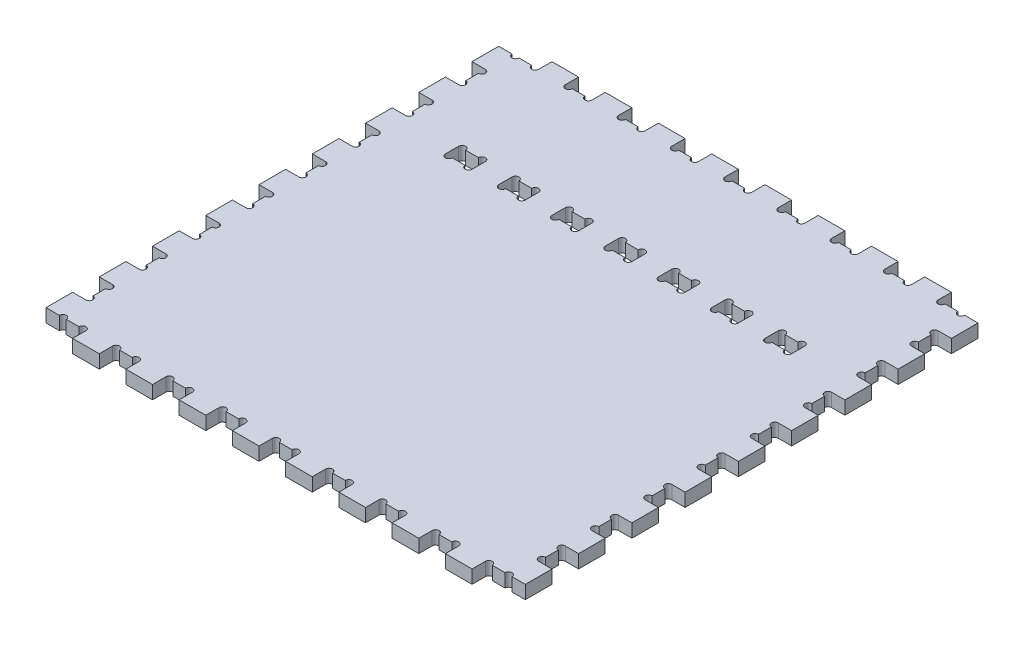
from build123d import *

# Parameters (mm, degrees)
SKETCH1_W               = 457.2
SKETCH1_H               = 457.2
BOSS_EXTRUDE1_DEPTH     = 12.7
CUT_EXTRUDE1_DEPTH      = 12.7
LPATTERN1_COUNT         = 9
LPATTERN1_PITCH         = 50.8
MIRROR1_COPY_1_DEPTH    = 12.7
MIRROR1_COPY_2_DEPTH    = 12.7
MIRROR1_COPY_3_DEPTH    = 12.7
MIRROR1_COPY_4_DEPTH    = 12.7
MIRROR1_COPY_5_DEPTH    = 12.7
MIRROR1_COPY_6_DEPTH    = 12.7
MIRROR1_COPY_7_DEPTH    = 12.7
MIRROR1_COPY_8_DEPTH    = 12.7
SKETCH3_W               = 12.7
SKETCH3_H               = 12.7
CUT_EXTRUDE2_DEPTH      = 324.538575753
MIRROR3_COPY_1_SKETCH_W = 12.7
MIRROR3_COPY_1_SKETCH_H = 12.7
MIRROR3_COPY_1_DEPTH    = 324.538575753
SKETCH4_R               = 3.302
SKETCH4_W               = 12.7
SKETCH4_H               = 25.4
CUT_EXTRUDE3_DEPTH      = 324.538575753
LPATTERN2_COUNT         = 9
LPATTERN2_PITCH         = 50.8
MIRROR4_COPY_1_SKETCH_R = 3.302
MIRROR4_COPY_1_SKETCH_W = 12.7
MIRROR4_COPY_1_SKETCH_H = 25.4
MIRROR4_COPY_1_DEPTH    = 324.538575753
MIRROR4_COPY_2_SKETCH_R = 3.302
MIRROR4_COPY_2_SKETCH_W = 12.7
MIRROR4_COPY_2_SKETCH_H = 25.4
MIRROR4_COPY_2_DEPTH    = 324.538575753
MIRROR4_COPY_3_SKETCH_R = 3.302
MIRROR4_COPY_3_SKETCH_W = 12.7
MIRROR4_COPY_3_SKETCH_H = 25.4
MIRROR4_COPY_3_DEPTH    = 324.538575753
MIRROR4_COPY_4_SKETCH_R = 3.302
MIRROR4_COPY_4_SKETCH_W = 12.7
MIRROR4_COPY_4_SKETCH_H = 25.4
MIRROR4_COPY_4_DEPTH    = 324.538575753
MIRROR4_COPY_5_SKETCH_R = 3.302
MIRROR4_COPY_5_SKETCH_W = 12.7
MIRROR4_COPY_5_SKETCH_H = 25.4
MIRROR4_COPY_5_DEPTH    = 324.538575753
MIRROR4_COPY_6_SKETCH_R = 3.302
MIRROR4_COPY_6_SKETCH_W = 12.7
MIRROR4_COPY_6_SKETCH_H = 25.4
MIRROR4_COPY_6_DEPTH    = 324.538575753
MIRROR4_COPY_7_SKETCH_R = 3.302
MIRROR4_COPY_7_SKETCH_W = 12.7
MIRROR4_COPY_7_SKETCH_H = 25.4
MIRROR4_COPY_7_DEPTH    = 324.538575753
MIRROR4_COPY_8_SKETCH_R = 3.302
MIRROR4_COPY_8_SKETCH_W = 12.7
MIRROR4_COPY_8_SKETCH_H = 25.4
MIRROR4_COPY_8_DEPTH    = 324.538575753
CUT_EXTRUDE4_DEPTH      = 324.538575753
LPATTERN3_COUNT         = 7
LPATTERN3_PITCH         = 50.8


with BuildPart() as part:
    # Sketch1 → Boss-Extrude1 (new body)
    with BuildSketch(Plane(origin=(0, 0, 0), x_dir=(1, 0, 0), z_dir=(0, 1, 0))):
        Rectangle(SKETCH1_W, SKETCH1_H)
    extrude(amount=BOSS_EXTRUDE1_DEPTH)

    # Sketch2 → Cut-Extrude1 (cut)
    with BuildSketch(Plane(origin=(0, 12.7, 0), x_dir=(1, 0, 0), z_dir=(0, 1, 0))):
        with BuildLine():
            Line((-190.5, 228.6), (-215.9, 228.6))
            Line((-215.9, 228.6), (-215.9, 215.9))
            ThreePointArc((-215.9, 215.9), (-212.598, 219.202), (-209.296, 215.9))
            Line((-209.296, 215.9), (-197.104, 215.9))
            ThreePointArc((-197.104, 215.9), (-193.802, 219.202), (-190.5, 215.9))
            Line((-190.5, 215.9), (-190.5, 228.6))
        make_face()
        with BuildLine():
            ThreePointArc((-209.296, 215.9), (-212.598, 219.202), (-215.9, 215.9))
            Line((-215.9, 215.9), (-209.296, 215.9))
        make_face()
        with BuildLine():
            Line((-209.296, 215.9), (-215.9, 215.9))
            ThreePointArc((-215.9, 215.9), (-212.598, 212.598), (-209.296, 215.9))
        make_face()
        with BuildLine():
            ThreePointArc((-197.104, 215.9), (-193.802, 212.598), (-190.5, 215.9))
            Line((-190.5, 215.9), (-197.104, 215.9))
        make_face()
        with BuildLine():
            Line((-197.104, 215.9), (-190.5, 215.9))
            ThreePointArc((-190.5, 215.9), (-193.802, 219.202), (-197.104, 215.9))
        make_face()
    cut_extrude1 = extrude(amount=-CUT_EXTRUDE1_DEPTH, mode=Mode.SUBTRACT)

    # LPattern1: Cut-Extrude1 ×9
    with Locations(*[(i * LPATTERN1_PITCH, 0, 0) for i in range(1, LPATTERN1_COUNT)]):
        add(cut_extrude1, mode=Mode.SUBTRACT)

    # Mirror1: Cut-Extrude1 across plane
    add(cut_extrude1.mirror(Plane(origin=(0, 0, 0), x_dir=(1, 0, 0), z_dir=(0, 0, -1))), mode=Mode.SUBTRACT)

    # Mirror1 copy 1 sketch → Mirror1 copy 1 (cut)
    with BuildSketch(Plane(origin=(50.8, 12.7, 0), x_dir=(1, 0, 0), z_dir=(0, 1, 0))):
        with BuildLine():
            Line((-190.5, -228.6), (-215.9, -228.6))
            Line((-215.9, -228.6), (-215.9, -215.9))
            ThreePointArc((-215.9, -215.9), (-212.598, -219.202), (-209.296, -215.9))
            Line((-209.296, -215.9), (-197.104, -215.9))
            ThreePointArc((-197.104, -215.9), (-193.802, -219.202), (-190.5, -215.9))
            Line((-190.5, -215.9), (-190.5, -228.6))
        make_face()
        with BuildLine():
            ThreePointArc((-209.296, -215.9), (-212.598, -219.202), (-215.9, -215.9))
            Line((-215.9, -215.9), (-209.296, -215.9))
        make_face()
        with BuildLine():
            Line((-209.296, -215.9), (-215.9, -215.9))
            ThreePointArc((-215.9, -215.9), (-212.598, -212.598), (-209.296, -215.9))
        make_face()
        with BuildLine():
            ThreePointArc((-197.104, -215.9), (-193.802, -212.598), (-190.5, -215.9))
            Line((-190.5, -215.9), (-197.104, -215.9))
        make_face()
        with BuildLine():
            Line((-197.104, -215.9), (-190.5, -215.9))
            ThreePointArc((-190.5, -215.9), (-193.802, -219.202), (-197.104, -215.9))
        make_face()
    extrude(amount=-MIRROR1_COPY_1_DEPTH, mode=Mode.SUBTRACT)

    # Mirror1 copy 2 sketch → Mirror1 copy 2 (cut)
    with BuildSketch(Plane(origin=(101.6, 12.7, 0), x_dir=(1, 0, 0), z_dir=(0, 1, 0))):
        with BuildLine():
            Line((-190.5, -228.6), (-215.9, -228.6))
            Line((-215.9, -228.6), (-215.9, -215.9))
            ThreePointArc((-215.9, -215.9), (-212.598, -219.202), (-209.296, -215.9))
            Line((-209.296, -215.9), (-197.104, -215.9))
            ThreePointArc((-197.104, -215.9), (-193.802, -219.202), (-190.5, -215.9))
            Line((-190.5, -215.9), (-190.5, -228.6))
        make_face()
        with BuildLine():
            ThreePointArc((-209.296, -215.9), (-212.598, -219.202), (-215.9, -215.9))
            Line((-215.9, -215.9), (-209.296, -215.9))
        make_face()
        with BuildLine():
            Line((-209.296, -215.9), (-215.9, -215.9))
            ThreePointArc((-215.9, -215.9), (-212.598, -212.598), (-209.296, -215.9))
        make_face()
        with BuildLine():
            ThreePointArc((-197.104, -215.9), (-193.802, -212.598), (-190.5, -215.9))
            Line((-190.5, -215.9), (-197.104, -215.9))
        make_face()
        with BuildLine():
            Line((-197.104, -215.9), (-190.5, -215.9))
            ThreePointArc((-190.5, -215.9), (-193.802, -219.202), (-197.104, -215.9))
        make_face()
    extrude(amount=-MIRROR1_COPY_2_DEPTH, mode=Mode.SUBTRACT)

    # Mirror1 copy 3 sketch → Mirror1 copy 3 (cut)
    with BuildSketch(Plane(origin=(152.4, 12.7, 0), x_dir=(1, 0, 0), z_dir=(0, 1, 0))):
        with BuildLine():
            Line((-190.5, -228.6), (-215.9, -228.6))
            Line((-215.9, -228.6), (-215.9, -215.9))
            ThreePointArc((-215.9, -215.9), (-212.598, -219.202), (-209.296, -215.9))
            Line((-209.296, -215.9), (-197.104, -215.9))
            ThreePointArc((-197.104, -215.9), (-193.802, -219.202), (-190.5, -215.9))
            Line((-190.5, -215.9), (-190.5, -228.6))
        make_face()
        with BuildLine():
            ThreePointArc((-209.296, -215.9), (-212.598, -219.202), (-215.9, -215.9))
            Line((-215.9, -215.9), (-209.296, -215.9))
        make_face()
        with BuildLine():
            Line((-209.296, -215.9), (-215.9, -215.9))
            ThreePointArc((-215.9, -215.9), (-212.598, -212.598), (-209.296, -215.9))
        make_face()
        with BuildLine():
            ThreePointArc((-197.104, -215.9), (-193.802, -212.598), (-190.5, -215.9))
            Line((-190.5, -215.9), (-197.104, -215.9))
        make_face()
        with BuildLine():
            Line((-197.104, -215.9), (-190.5, -215.9))
            ThreePointArc((-190.5, -215.9), (-193.802, -219.202), (-197.104, -215.9))
        make_face()
    extrude(amount=-MIRROR1_COPY_3_DEPTH, mode=Mode.SUBTRACT)

    # Mirror1 copy 4 sketch → Mirror1 copy 4 (cut)
    with BuildSketch(Plane(origin=(203.2, 12.7, 0), x_dir=(1, 0, 0), z_dir=(0, 1, 0))):
        with BuildLine():
            Line((-190.5, -228.6), (-215.9, -228.6))
            Line((-215.9, -228.6), (-215.9, -215.9))
            ThreePointArc((-215.9, -215.9), (-212.598, -219.202), (-209.296, -215.9))
            Line((-209.296, -215.9), (-197.104, -215.9))
            ThreePointArc((-197.104, -215.9), (-193.802, -219.202), (-190.5, -215.9))
            Line((-190.5, -215.9), (-190.5, -228.6))
        make_face()
        with BuildLine():
            ThreePointArc((-209.296, -215.9), (-212.598, -219.202), (-215.9, -215.9))
            Line((-215.9, -215.9), (-209.296, -215.9))
        make_face()
        with BuildLine():
            Line((-209.296, -215.9), (-215.9, -215.9))
            ThreePointArc((-215.9, -215.9), (-212.598, -212.598), (-209.296, -215.9))
        make_face()
        with BuildLine():
            ThreePointArc((-197.104, -215.9), (-193.802, -212.598), (-190.5, -215.9))
            Line((-190.5, -215.9), (-197.104, -215.9))
        make_face()
        with BuildLine():
            Line((-197.104, -215.9), (-190.5, -215.9))
            ThreePointArc((-190.5, -215.9), (-193.802, -219.202), (-197.104, -215.9))
        make_face()
    extrude(amount=-MIRROR1_COPY_4_DEPTH, mode=Mode.SUBTRACT)

    # Mirror1 copy 5 sketch → Mirror1 copy 5 (cut)
    with BuildSketch(Plane(origin=(254, 12.7, 0), x_dir=(1, 0, 0), z_dir=(0, 1, 0))):
        with BuildLine():
            Line((-190.5, -228.6), (-215.9, -228.6))
            Line((-215.9, -228.6), (-215.9, -215.9))
            ThreePointArc((-215.9, -215.9), (-212.598, -219.202), (-209.296, -215.9))
            Line((-209.296, -215.9), (-197.104, -215.9))
            ThreePointArc((-197.104, -215.9), (-193.802, -219.202), (-190.5, -215.9))
            Line((-190.5, -215.9), (-190.5, -228.6))
        make_face()
        with BuildLine():
            ThreePointArc((-209.296, -215.9), (-212.598, -219.202), (-215.9, -215.9))
            Line((-215.9, -215.9), (-209.296, -215.9))
        make_face()
        with BuildLine():
            Line((-209.296, -215.9), (-215.9, -215.9))
            ThreePointArc((-215.9, -215.9), (-212.598, -212.598), (-209.296, -215.9))
        make_face()
        with BuildLine():
            ThreePointArc((-197.104, -215.9), (-193.802, -212.598), (-190.5, -215.9))
            Line((-190.5, -215.9), (-197.104, -215.9))
        make_face()
        with BuildLine():
            Line((-197.104, -215.9), (-190.5, -215.9))
            ThreePointArc((-190.5, -215.9), (-193.802, -219.202), (-197.104, -215.9))
        make_face()
    extrude(amount=-MIRROR1_COPY_5_DEPTH, mode=Mode.SUBTRACT)

    # Mirror1 copy 6 sketch → Mirror1 copy 6 (cut)
    with BuildSketch(Plane(origin=(304.8, 12.7, 0), x_dir=(1, 0, 0), z_dir=(0, 1, 0))):
        with BuildLine():
            Line((-190.5, -228.6), (-215.9, -228.6))
            Line((-215.9, -228.6), (-215.9, -215.9))
            ThreePointArc((-215.9, -215.9), (-212.598, -219.202), (-209.296, -215.9))
            Line((-209.296, -215.9), (-197.104, -215.9))
            ThreePointArc((-197.104, -215.9), (-193.802, -219.202), (-190.5, -215.9))
            Line((-190.5, -215.9), (-190.5, -228.6))
        make_face()
        with BuildLine():
            ThreePointArc((-209.296, -215.9), (-212.598, -219.202), (-215.9, -215.9))
            Line((-215.9, -215.9), (-209.296, -215.9))
        make_face()
        with BuildLine():
            Line((-209.296, -215.9), (-215.9, -215.9))
            ThreePointArc((-215.9, -215.9), (-212.598, -212.598), (-209.296, -215.9))
        make_face()
        with BuildLine():
            ThreePointArc((-197.104, -215.9), (-193.802, -212.598), (-190.5, -215.9))
            Line((-190.5, -215.9), (-197.104, -215.9))
        make_face()
        with BuildLine():
            Line((-197.104, -215.9), (-190.5, -215.9))
            ThreePointArc((-190.5, -215.9), (-193.802, -219.202), (-197.104, -215.9))
        make_face()
    extrude(amount=-MIRROR1_COPY_6_DEPTH, mode=Mode.SUBTRACT)

    # Mirror1 copy 7 sketch → Mirror1 copy 7 (cut)
    with BuildSketch(Plane(origin=(355.6, 12.7, 0), x_dir=(1, 0, 0), z_dir=(0, 1, 0))):
        with BuildLine():
            Line((-190.5, -228.6), (-215.9, -228.6))
            Line((-215.9, -228.6), (-215.9, -215.9))
            ThreePointArc((-215.9, -215.9), (-212.598, -219.202), (-209.296, -215.9))
            Line((-209.296, -215.9), (-197.104, -215.9))
            ThreePointArc((-197.104, -215.9), (-193.802, -219.202), (-190.5, -215.9))
            Line((-190.5, -215.9), (-190.5, -228.6))
        make_face()
        with BuildLine():
            ThreePointArc((-209.296, -215.9), (-212.598, -219.202), (-215.9, -215.9))
            Line((-215.9, -215.9), (-209.296, -215.9))
        make_face()
        with BuildLine():
            Line((-209.296, -215.9), (-215.9, -215.9))
            ThreePointArc((-215.9, -215.9), (-212.598, -212.598), (-209.296, -215.9))
        make_face()
        with BuildLine():
            ThreePointArc((-197.104, -215.9), (-193.802, -212.598), (-190.5, -215.9))
            Line((-190.5, -215.9), (-197.104, -215.9))
        make_face()
        with BuildLine():
            Line((-197.104, -215.9), (-190.5, -215.9))
            ThreePointArc((-190.5, -215.9), (-193.802, -219.202), (-197.104, -215.9))
        make_face()
    extrude(amount=-MIRROR1_COPY_7_DEPTH, mode=Mode.SUBTRACT)

    # Mirror1 copy 8 sketch → Mirror1 copy 8 (cut)
    with BuildSketch(Plane(origin=(406.4, 12.7, 0), x_dir=(1, 0, 0), z_dir=(0, 1, 0))):
        with BuildLine():
            Line((-190.5, -228.6), (-215.9, -228.6))
            Line((-215.9, -228.6), (-215.9, -215.9))
            ThreePointArc((-215.9, -215.9), (-212.598, -219.202), (-209.296, -215.9))
            Line((-209.296, -215.9), (-197.104, -215.9))
            ThreePointArc((-197.104, -215.9), (-193.802, -219.202), (-190.5, -215.9))
            Line((-190.5, -215.9), (-190.5, -228.6))
        make_face()
        with BuildLine():
            ThreePointArc((-209.296, -215.9), (-212.598, -219.202), (-215.9, -215.9))
            Line((-215.9, -215.9), (-209.296, -215.9))
        make_face()
        with BuildLine():
            Line((-209.296, -215.9), (-215.9, -215.9))
            ThreePointArc((-215.9, -215.9), (-212.598, -212.598), (-209.296, -215.9))
        make_face()
        with BuildLine():
            ThreePointArc((-197.104, -215.9), (-193.802, -212.598), (-190.5, -215.9))
            Line((-190.5, -215.9), (-197.104, -215.9))
        make_face()
        with BuildLine():
            Line((-197.104, -215.9), (-190.5, -215.9))
            ThreePointArc((-190.5, -215.9), (-193.802, -219.202), (-197.104, -215.9))
        make_face()
    extrude(amount=-MIRROR1_COPY_8_DEPTH, mode=Mode.SUBTRACT)

    # Sketch3 → Cut-Extrude2 (cut, through all)
    with BuildSketch(Plane(origin=(0, 12.7, 0), x_dir=(1, 0, 0), z_dir=(0, 1, 0))):
        with Locations((-222.25, 222.25)):
            Rectangle(SKETCH3_W, SKETCH3_H)
    cut_extrude2 = extrude(amount=-CUT_EXTRUDE2_DEPTH, mode=Mode.SUBTRACT)

    # Mirror2: Cut-Extrude2 across plane
    add(cut_extrude2.mirror(Plane.ZY), mode=Mode.SUBTRACT)

    # Mirror3: Cut-Extrude2 across plane
    add(cut_extrude2.mirror(Plane(origin=(0, 0, 0), x_dir=(1, 0, 0), z_dir=(0, 0, -1))), mode=Mode.SUBTRACT)

    # Mirror3 copy 1 sketch → Mirror3 copy 1 (cut, through all)
    with BuildSketch(Plane(origin=(0, 12.7, 0), x_dir=(-1, 0, 0), z_dir=(0, 1, 0))):
        with Locations((-222.25, 222.25)):
            Rectangle(MIRROR3_COPY_1_SKETCH_W, MIRROR3_COPY_1_SKETCH_H)
    extrude(amount=-MIRROR3_COPY_1_DEPTH, mode=Mode.SUBTRACT)

    # Sketch4 → Cut-Extrude3 (cut, through all)
    with BuildSketch(Plane(origin=(0, 12.7, 0), x_dir=(1, 0, 0), z_dir=(0, 1, 0))):
        with Locations((-215.9, 168.402)):
            Circle(SKETCH4_R)
        with Locations((-215.9, 187.198)):
            Circle(SKETCH4_R)
        with Locations((-222.25, 177.8)):
            Rectangle(SKETCH4_W, SKETCH4_H)
        with BuildLine():
            ThreePointArc((-212.598, 187.198), (-213.565133409, 189.532866591), (-215.9, 190.5))
            Line((-215.9, 190.5), (-215.9, 183.896))
            ThreePointArc((-215.9, 183.896), (-213.565133409, 184.863133409), (-212.598, 187.198))
        make_face()
        with BuildLine():
            Line((-215.9, 183.896), (-215.9, 190.5))
            ThreePointArc((-215.9, 190.5), (-219.202, 187.198), (-215.9, 183.896))
        make_face()
        with BuildLine():
            ThreePointArc((-215.9, 171.704), (-219.202, 168.402), (-215.9, 165.1))
            Line((-215.9, 165.1), (-215.9, 171.704))
        make_face()
        with BuildLine():
            Line((-215.9, 171.704), (-215.9, 165.1))
            ThreePointArc((-215.9, 165.1), (-213.565133409, 166.067133409), (-212.598, 168.402))
            ThreePointArc((-212.598, 168.402), (-213.565133409, 170.736866591), (-215.9, 171.704))
        make_face()
    cut_extrude3 = extrude(amount=-CUT_EXTRUDE3_DEPTH, mode=Mode.SUBTRACT)

    # LPattern2: Cut-Extrude3 ×9
    with Locations(*[(0, 0, i * LPATTERN2_PITCH) for i in range(1, LPATTERN2_COUNT)]):
        add(cut_extrude3, mode=Mode.SUBTRACT)

    # Mirror4: Cut-Extrude3 across plane
    add(cut_extrude3.mirror(Plane.ZY), mode=Mode.SUBTRACT)

    # Mirror4 copy 1 sketch → Mirror4 copy 1 (cut, through all)
    with BuildSketch(Plane(origin=(0, 12.7, 50.8), x_dir=(-1, 0, 0), z_dir=(0, 1, 0))):
        with Locations((-215.9, -168.402)):
            Circle(MIRROR4_COPY_1_SKETCH_R)
        with Locations((-215.9, -187.198)):
            Circle(MIRROR4_COPY_1_SKETCH_R)
        with Locations((-222.25, -177.8)):
            Rectangle(MIRROR4_COPY_1_SKETCH_W, MIRROR4_COPY_1_SKETCH_H)
        with BuildLine():
            ThreePointArc((-212.598, -187.198), (-213.565133409, -189.532866591), (-215.9, -190.5))
            Line((-215.9, -190.5), (-215.9, -183.896))
            ThreePointArc((-215.9, -183.896), (-213.565133409, -184.863133409), (-212.598, -187.198))
        make_face()
        with BuildLine():
            Line((-215.9, -183.896), (-215.9, -190.5))
            ThreePointArc((-215.9, -190.5), (-219.202, -187.198), (-215.9, -183.896))
        make_face()
        with BuildLine():
            ThreePointArc((-215.9, -171.704), (-219.202, -168.402), (-215.9, -165.1))
            Line((-215.9, -165.1), (-215.9, -171.704))
        make_face()
        with BuildLine():
            Line((-215.9, -171.704), (-215.9, -165.1))
            ThreePointArc((-215.9, -165.1), (-213.565133409, -166.067133409), (-212.598, -168.402))
            ThreePointArc((-212.598, -168.402), (-213.565133409, -170.736866591), (-215.9, -171.704))
        make_face()
    extrude(amount=-MIRROR4_COPY_1_DEPTH, mode=Mode.SUBTRACT)

    # Mirror4 copy 2 sketch → Mirror4 copy 2 (cut, through all)
    with BuildSketch(Plane(origin=(0, 12.7, 101.6), x_dir=(-1, 0, 0), z_dir=(0, 1, 0))):
        with Locations((-215.9, -168.402)):
            Circle(MIRROR4_COPY_2_SKETCH_R)
        with Locations((-215.9, -187.198)):
            Circle(MIRROR4_COPY_2_SKETCH_R)
        with Locations((-222.25, -177.8)):
            Rectangle(MIRROR4_COPY_2_SKETCH_W, MIRROR4_COPY_2_SKETCH_H)
        with BuildLine():
            ThreePointArc((-212.598, -187.198), (-213.565133409, -189.532866591), (-215.9, -190.5))
            Line((-215.9, -190.5), (-215.9, -183.896))
            ThreePointArc((-215.9, -183.896), (-213.565133409, -184.863133409), (-212.598, -187.198))
        make_face()
        with BuildLine():
            Line((-215.9, -183.896), (-215.9, -190.5))
            ThreePointArc((-215.9, -190.5), (-219.202, -187.198), (-215.9, -183.896))
        make_face()
        with BuildLine():
            ThreePointArc((-215.9, -171.704), (-219.202, -168.402), (-215.9, -165.1))
            Line((-215.9, -165.1), (-215.9, -171.704))
        make_face()
        with BuildLine():
            Line((-215.9, -171.704), (-215.9, -165.1))
            ThreePointArc((-215.9, -165.1), (-213.565133409, -166.067133409), (-212.598, -168.402))
            ThreePointArc((-212.598, -168.402), (-213.565133409, -170.736866591), (-215.9, -171.704))
        make_face()
    extrude(amount=-MIRROR4_COPY_2_DEPTH, mode=Mode.SUBTRACT)

    # Mirror4 copy 3 sketch → Mirror4 copy 3 (cut, through all)
    with BuildSketch(Plane(origin=(0, 12.7, 152.4), x_dir=(-1, 0, 0), z_dir=(0, 1, 0))):
        with Locations((-215.9, -168.402)):
            Circle(MIRROR4_COPY_3_SKETCH_R)
        with Locations((-215.9, -187.198)):
            Circle(MIRROR4_COPY_3_SKETCH_R)
        with Locations((-222.25, -177.8)):
            Rectangle(MIRROR4_COPY_3_SKETCH_W, MIRROR4_COPY_3_SKETCH_H)
        with BuildLine():
            ThreePointArc((-212.598, -187.198), (-213.565133409, -189.532866591), (-215.9, -190.5))
            Line((-215.9, -190.5), (-215.9, -183.896))
            ThreePointArc((-215.9, -183.896), (-213.565133409, -184.863133409), (-212.598, -187.198))
        make_face()
        with BuildLine():
            Line((-215.9, -183.896), (-215.9, -190.5))
            ThreePointArc((-215.9, -190.5), (-219.202, -187.198), (-215.9, -183.896))
        make_face()
        with BuildLine():
            ThreePointArc((-215.9, -171.704), (-219.202, -168.402), (-215.9, -165.1))
            Line((-215.9, -165.1), (-215.9, -171.704))
        make_face()
        with BuildLine():
            Line((-215.9, -171.704), (-215.9, -165.1))
            ThreePointArc((-215.9, -165.1), (-213.565133409, -166.067133409), (-212.598, -168.402))
            ThreePointArc((-212.598, -168.402), (-213.565133409, -170.736866591), (-215.9, -171.704))
        make_face()
    extrude(amount=-MIRROR4_COPY_3_DEPTH, mode=Mode.SUBTRACT)

    # Mirror4 copy 4 sketch → Mirror4 copy 4 (cut, through all)
    with BuildSketch(Plane(origin=(0, 12.7, 203.2), x_dir=(-1, 0, 0), z_dir=(0, 1, 0))):
        with Locations((-215.9, -168.402)):
            Circle(MIRROR4_COPY_4_SKETCH_R)
        with Locations((-215.9, -187.198)):
            Circle(MIRROR4_COPY_4_SKETCH_R)
        with Locations((-222.25, -177.8)):
            Rectangle(MIRROR4_COPY_4_SKETCH_W, MIRROR4_COPY_4_SKETCH_H)
        with BuildLine():
            ThreePointArc((-212.598, -187.198), (-213.565133409, -189.532866591), (-215.9, -190.5))
            Line((-215.9, -190.5), (-215.9, -183.896))
            ThreePointArc((-215.9, -183.896), (-213.565133409, -184.863133409), (-212.598, -187.198))
        make_face()
        with BuildLine():
            Line((-215.9, -183.896), (-215.9, -190.5))
            ThreePointArc((-215.9, -190.5), (-219.202, -187.198), (-215.9, -183.896))
        make_face()
        with BuildLine():
            ThreePointArc((-215.9, -171.704), (-219.202, -168.402), (-215.9, -165.1))
            Line((-215.9, -165.1), (-215.9, -171.704))
        make_face()
        with BuildLine():
            Line((-215.9, -171.704), (-215.9, -165.1))
            ThreePointArc((-215.9, -165.1), (-213.565133409, -166.067133409), (-212.598, -168.402))
            ThreePointArc((-212.598, -168.402), (-213.565133409, -170.736866591), (-215.9, -171.704))
        make_face()
    extrude(amount=-MIRROR4_COPY_4_DEPTH, mode=Mode.SUBTRACT)

    # Mirror4 copy 5 sketch → Mirror4 copy 5 (cut, through all)
    with BuildSketch(Plane(origin=(0, 12.7, 254), x_dir=(-1, 0, 0), z_dir=(0, 1, 0))):
        with Locations((-215.9, -168.402)):
            Circle(MIRROR4_COPY_5_SKETCH_R)
        with Locations((-215.9, -187.198)):
            Circle(MIRROR4_COPY_5_SKETCH_R)
        with Locations((-222.25, -177.8)):
            Rectangle(MIRROR4_COPY_5_SKETCH_W, MIRROR4_COPY_5_SKETCH_H)
        with BuildLine():
            ThreePointArc((-212.598, -187.198), (-213.565133409, -189.532866591), (-215.9, -190.5))
            Line((-215.9, -190.5), (-215.9, -183.896))
            ThreePointArc((-215.9, -183.896), (-213.565133409, -184.863133409), (-212.598, -187.198))
        make_face()
        with BuildLine():
            Line((-215.9, -183.896), (-215.9, -190.5))
            ThreePointArc((-215.9, -190.5), (-219.202, -187.198), (-215.9, -183.896))
        make_face()
        with BuildLine():
            ThreePointArc((-215.9, -171.704), (-219.202, -168.402), (-215.9, -165.1))
            Line((-215.9, -165.1), (-215.9, -171.704))
        make_face()
        with BuildLine():
            Line((-215.9, -171.704), (-215.9, -165.1))
            ThreePointArc((-215.9, -165.1), (-213.565133409, -166.067133409), (-212.598, -168.402))
            ThreePointArc((-212.598, -168.402), (-213.565133409, -170.736866591), (-215.9, -171.704))
        make_face()
    extrude(amount=-MIRROR4_COPY_5_DEPTH, mode=Mode.SUBTRACT)

    # Mirror4 copy 6 sketch → Mirror4 copy 6 (cut, through all)
    with BuildSketch(Plane(origin=(0, 12.7, 304.8), x_dir=(-1, 0, 0), z_dir=(0, 1, 0))):
        with Locations((-215.9, -168.402)):
            Circle(MIRROR4_COPY_6_SKETCH_R)
        with Locations((-215.9, -187.198)):
            Circle(MIRROR4_COPY_6_SKETCH_R)
        with Locations((-222.25, -177.8)):
            Rectangle(MIRROR4_COPY_6_SKETCH_W, MIRROR4_COPY_6_SKETCH_H)
        with BuildLine():
            ThreePointArc((-212.598, -187.198), (-213.565133409, -189.532866591), (-215.9, -190.5))
            Line((-215.9, -190.5), (-215.9, -183.896))
            ThreePointArc((-215.9, -183.896), (-213.565133409, -184.863133409), (-212.598, -187.198))
        make_face()
        with BuildLine():
            Line((-215.9, -183.896), (-215.9, -190.5))
            ThreePointArc((-215.9, -190.5), (-219.202, -187.198), (-215.9, -183.896))
        make_face()
        with BuildLine():
            ThreePointArc((-215.9, -171.704), (-219.202, -168.402), (-215.9, -165.1))
            Line((-215.9, -165.1), (-215.9, -171.704))
        make_face()
        with BuildLine():
            Line((-215.9, -171.704), (-215.9, -165.1))
            ThreePointArc((-215.9, -165.1), (-213.565133409, -166.067133409), (-212.598, -168.402))
            ThreePointArc((-212.598, -168.402), (-213.565133409, -170.736866591), (-215.9, -171.704))
        make_face()
    extrude(amount=-MIRROR4_COPY_6_DEPTH, mode=Mode.SUBTRACT)

    # Mirror4 copy 7 sketch → Mirror4 copy 7 (cut, through all)
    with BuildSketch(Plane(origin=(0, 12.7, 355.6), x_dir=(-1, 0, 0), z_dir=(0, 1, 0))):
        with Locations((-215.9, -168.402)):
            Circle(MIRROR4_COPY_7_SKETCH_R)
        with Locations((-215.9, -187.198)):
            Circle(MIRROR4_COPY_7_SKETCH_R)
        with Locations((-222.25, -177.8)):
            Rectangle(MIRROR4_COPY_7_SKETCH_W, MIRROR4_COPY_7_SKETCH_H)
        with BuildLine():
            ThreePointArc((-212.598, -187.198), (-213.565133409, -189.532866591), (-215.9, -190.5))
            Line((-215.9, -190.5), (-215.9, -183.896))
            ThreePointArc((-215.9, -183.896), (-213.565133409, -184.863133409), (-212.598, -187.198))
        make_face()
        with BuildLine():
            Line((-215.9, -183.896), (-215.9, -190.5))
            ThreePointArc((-215.9, -190.5), (-219.202, -187.198), (-215.9, -183.896))
        make_face()
        with BuildLine():
            ThreePointArc((-215.9, -171.704), (-219.202, -168.402), (-215.9, -165.1))
            Line((-215.9, -165.1), (-215.9, -171.704))
        make_face()
        with BuildLine():
            Line((-215.9, -171.704), (-215.9, -165.1))
            ThreePointArc((-215.9, -165.1), (-213.565133409, -166.067133409), (-212.598, -168.402))
            ThreePointArc((-212.598, -168.402), (-213.565133409, -170.736866591), (-215.9, -171.704))
        make_face()
    extrude(amount=-MIRROR4_COPY_7_DEPTH, mode=Mode.SUBTRACT)

    # Mirror4 copy 8 sketch → Mirror4 copy 8 (cut, through all)
    with BuildSketch(Plane(origin=(0, 12.7, 406.4), x_dir=(-1, 0, 0), z_dir=(0, 1, 0))):
        with Locations((-215.9, -168.402)):
            Circle(MIRROR4_COPY_8_SKETCH_R)
        with Locations((-215.9, -187.198)):
            Circle(MIRROR4_COPY_8_SKETCH_R)
        with Locations((-222.25, -177.8)):
            Rectangle(MIRROR4_COPY_8_SKETCH_W, MIRROR4_COPY_8_SKETCH_H)
        with BuildLine():
            ThreePointArc((-212.598, -187.198), (-213.565133409, -189.532866591), (-215.9, -190.5))
            Line((-215.9, -190.5), (-215.9, -183.896))
            ThreePointArc((-215.9, -183.896), (-213.565133409, -184.863133409), (-212.598, -187.198))
        make_face()
        with BuildLine():
            Line((-215.9, -183.896), (-215.9, -190.5))
            ThreePointArc((-215.9, -190.5), (-219.202, -187.198), (-215.9, -183.896))
        make_face()
        with BuildLine():
            ThreePointArc((-215.9, -171.704), (-219.202, -168.402), (-215.9, -165.1))
            Line((-215.9, -165.1), (-215.9, -171.704))
        make_face()
        with BuildLine():
            Line((-215.9, -171.704), (-215.9, -165.1))
            ThreePointArc((-215.9, -165.1), (-213.565133409, -166.067133409), (-212.598, -168.402))
            ThreePointArc((-212.598, -168.402), (-213.565133409, -170.736866591), (-215.9, -171.704))
        make_face()
    extrude(amount=-MIRROR4_COPY_8_DEPTH, mode=Mode.SUBTRACT)

    # Sketch5 → Cut-Extrude4 (cut, through all)
    with BuildSketch(Plane(origin=(0, 12.7, 0), x_dir=(1, 0, 0), z_dir=(0, 1, 0))):
        with BuildLine():
            Line((-158.496, 114.3), (-146.304, 114.3))
            ThreePointArc((-146.304, 114.3), (-143.002, 117.602), (-139.7, 114.3))
            Line((-139.7, 114.3), (-139.7, 101.6))
            ThreePointArc((-139.7, 101.6), (-143.002, 98.298), (-146.304, 101.6))
            Line((-146.304, 101.6), (-158.496, 101.6))
            ThreePointArc((-158.496, 101.6), (-161.798, 98.298), (-165.1, 101.6))
            Line((-165.1, 101.6), (-165.1, 114.3))
            ThreePointArc((-165.1, 114.3), (-161.798, 117.602), (-158.496, 114.3))
        make_face()
    cut_extrude4 = extrude(amount=-CUT_EXTRUDE4_DEPTH, mode=Mode.SUBTRACT)

    # LPattern3: Cut-Extrude4 ×7
    with Locations(*[(i * LPATTERN3_PITCH, 0, 0) for i in range(1, LPATTERN3_COUNT)]):
        add(cut_extrude4, mode=Mode.SUBTRACT)


solid = part.part
